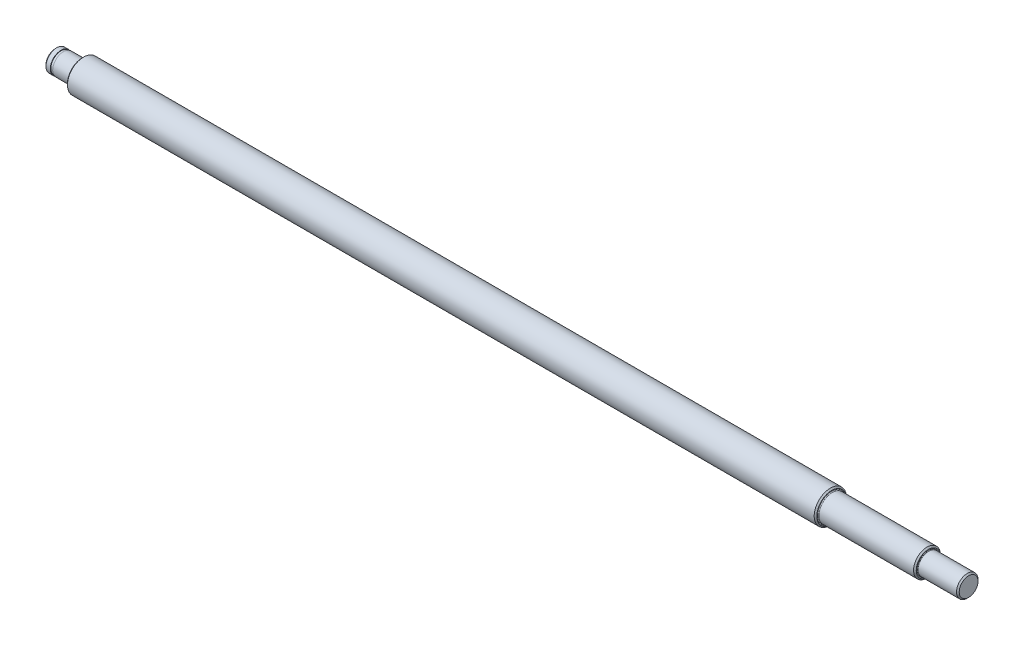
from build123d import *


with BuildPart() as part:
    # Sketch1 → Revolve1 (revolve)
    with BuildSketch(Plane.XY):
        with BuildLine():
            Line((2.1, 4), (2.1, 3.8))
            Line((2.1, 3.8), (3, 3.8))
            Line((3, 3.8), (3, 4))
            Line((3, 4), (9.7, 4))
            ThreePointArc((9.7, 4), (9.912132034, 4.087867966), (10, 4.3))
            Line((10, 4.3), (10, 5.5))
            Line((10, 5.5), (10.5, 6))
            Line((10.5, 6), (288.5, 6))
            Line((288.5, 6), (289, 5.5))
            Line((289, 5.5), (289, 5.3))
            ThreePointArc((289, 5.3), (289.087867966, 5.087867966), (289.3, 5))
            Line((289.3, 5), (324.5, 5))
            Line((324.5, 5), (325, 4.5))
            Line((325, 4.5), (325, 4.2))
            ThreePointArc((325, 4.2), (325.058578644, 4.058578644), (325.2, 4))
            Line((325.2, 4), (339.5, 4))
            Line((339.5, 4), (340, 3.5))
            Line((340, 3.5), (340, 0))
            Line((340, 0), (0, 0))
            Line((0, 0), (0, 3.5))
            Line((0, 3.5), (0.5, 4))
            Line((0.5, 4), (2.1, 4))
        make_face()
    revolve(axis=Axis((-20, 0, 0), (1, 0, 0)))


solid = part.part
